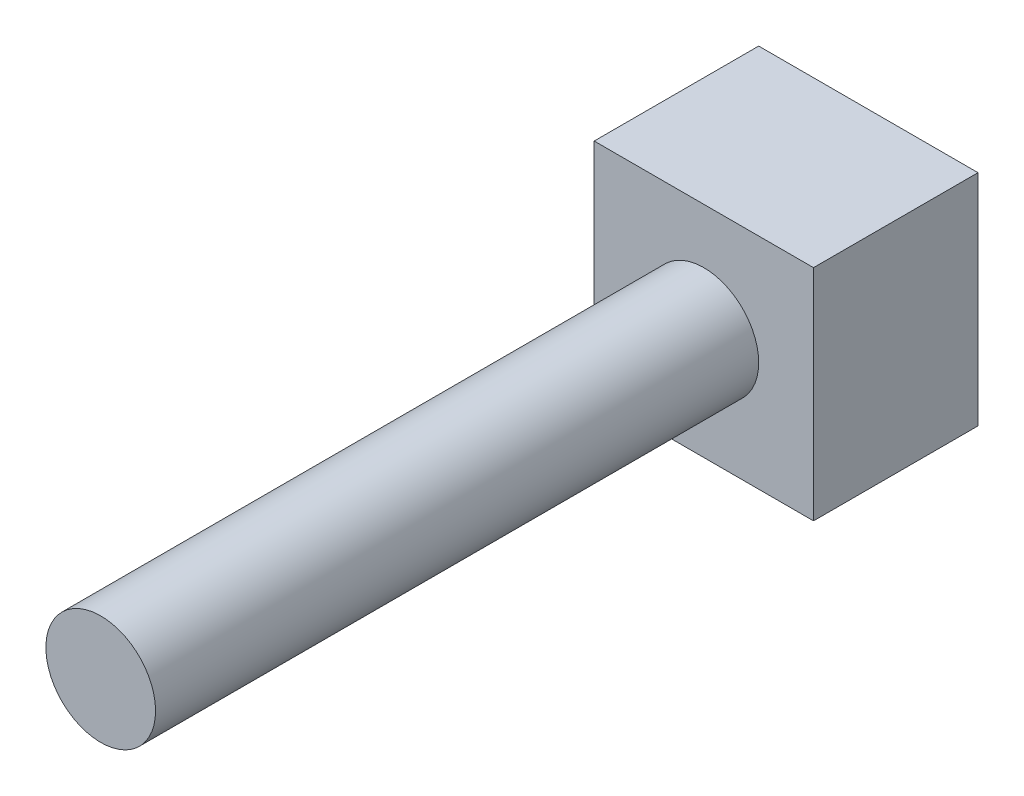
from build123d import *

# Parameters (mm, degrees)
SKETCH1_W           = 2
SKETCH1_H           = 2
BOSS_EXTRUDE1_DEPTH = 1.5
SKETCH2_R           = 0.5
BOSS_EXTRUDE2_DEPTH = 5.5


with BuildPart() as part:
    # Sketch1 → Boss-Extrude1 (new body)
    with BuildSketch(Plane.XY):
        Rectangle(SKETCH1_W, SKETCH1_H)
    extrude(amount=BOSS_EXTRUDE1_DEPTH)

    # Sketch2 → Boss-Extrude2 (add)
    with BuildSketch(Plane.XY.offset(1.5)):
        Circle(SKETCH2_R)
    extrude(amount=BOSS_EXTRUDE2_DEPTH)


solid = part.part
